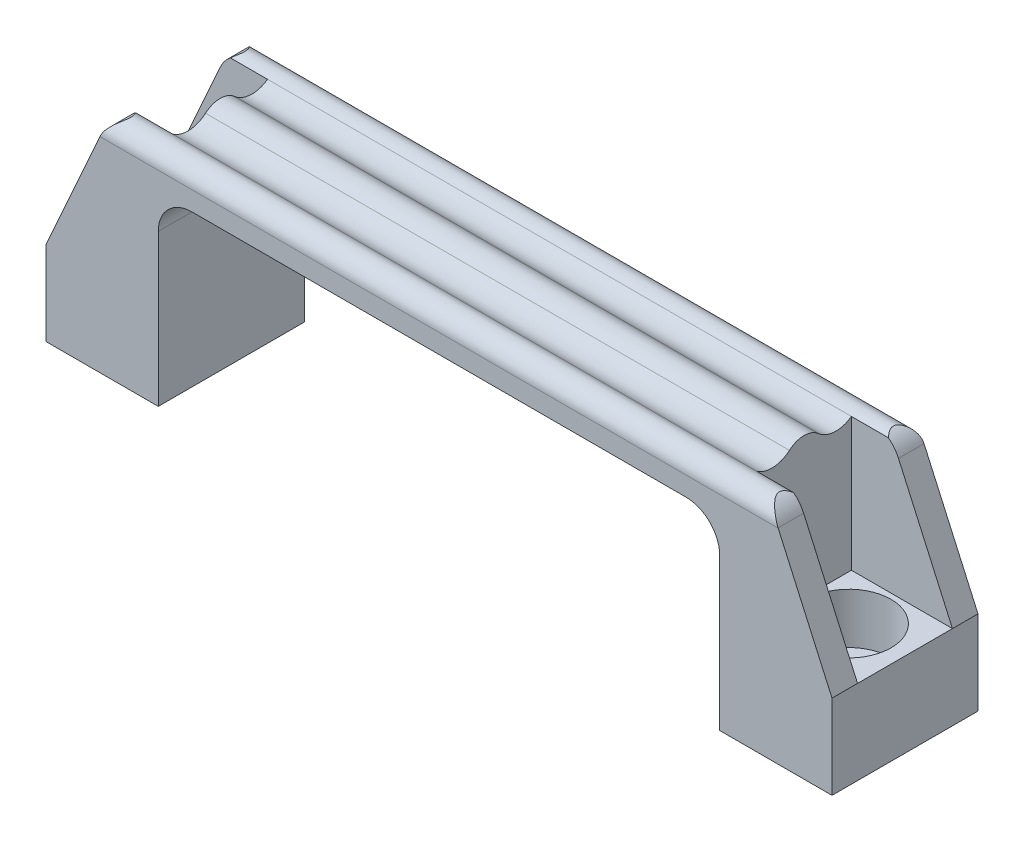
from build123d import *

# Parameters (mm, degrees)
EXTRUDE_START            = 13
EXTRUDE_1_DEPTH          = 26
CUT_EXTRUDE_1_DEPTH      = 70
CUT_EXTRUDE_1_DEPTH_BACK = 70
CUT_EXTRUDE_START        = 15
SKETCH_5_W               = 18
SKETCH_5_H               = 16.9
CUT_EXTRUDE_2_DEPTH      = 25
CUT_EXTRUDE_START_2      = 52.5
SKETCH_7_W               = 1.68
SKETCH_7_H               = 11.25
CUT_EXTRUDE_3_DEPTH      = 15
CUT_EXTRUDE_START_3      = -67.5
SKETCH_7_2_W             = 1.68
SKETCH_7_2_H             = 11.25
CUT_EXTRUDE_4_DEPTH      = 15


with BuildPart() as part:
    # 草图3 → 凸台-拉伸1 (new body)
    with BuildSketch(Plane.XY.offset(EXTRUDE_START)):
        with BuildLine():
            Line((-70, 15), (-60.389021238, 36.453077594))
            ThreePointArc((-60.389021238, 36.453077594), (-58.175420496, 39.035795149), (-54.913401609, 40))
            Line((-54.913401609, 40), (54.913401609, 40))
            ThreePointArc((54.913401609, 40), (58.175420496, 39.035795149), (60.389021238, 36.453077594))
            Line((60.389021238, 36.453077594), (70, 15))
            Line((70, 15), (70, 0))
            Line((70, 0), (50, 0))
            Line((50, 0), (50, 27))
            ThreePointArc((50, 27), (48.242640687, 31.242640687), (44, 33))
            Line((44, 33), (-44, 33))
            ThreePointArc((-44, 33), (-48.242640687, 31.242640687), (-50, 27))
            Line((-50, 27), (-50, 0))
            Line((-50, 0), (-70, 0))
            Line((-70, 0), (-70, 15))
        make_face()
    extrude(amount=-EXTRUDE_1_DEPTH)

    # 草图4 → 切除-拉伸1 (cut, two sides: drawn at the far end of the back side and taken through both)
    with BuildSketch(Plane(origin=(0, 0, 0), x_dir=(0, 0, -1), z_dir=(1, 0, 0)).offset(-CUT_EXTRUDE_1_DEPTH_BACK)):
        with BuildLine():
            Line((13, 36.42), (13, 33))
            Line((13, 33), (14, 33))
            Line((14, 33), (14, 41))
            Line((14, 41), (0, 41))
            Line((0, 41), (0, 40))
            ThreePointArc((0, 40), (1.385720645, 39.745514819), (2.590597511, 39.01527092))
            ThreePointArc((2.590597511, 39.01527092), (5.473035012, 37.839069568), (8.455602061, 38.731364009))
            ThreePointArc((8.455602061, 38.731364009), (11.436576626, 38.969213419), (13, 36.42))
        make_face()
        with BuildLine():
            Line((-14, 33), (-13, 33))
            Line((-13, 33), (-13, 36.42))
            ThreePointArc((-13, 36.42), (-11.436576626, 38.969213419), (-8.455602061, 38.731364009))
            ThreePointArc((-8.455602061, 38.731364009), (-5.473035012, 37.839069568), (-2.590597511, 39.01527092))
            ThreePointArc((-2.590597511, 39.01527092), (-1.385720645, 39.745514819), (0, 40))
            Line((0, 40), (0, 41))
            Line((0, 41), (-14, 41))
            Line((-14, 41), (-14, 33))
        make_face()
    extrude(amount=CUT_EXTRUDE_1_DEPTH + CUT_EXTRUDE_1_DEPTH_BACK, mode=Mode.SUBTRACT)

    # 草图5 → 切除-拉伸2 (cut)
    with BuildSketch(Plane(origin=(0, 0, 0), x_dir=(1, 0, 0), z_dir=(0, 1, 0)).offset(CUT_EXTRUDE_START)):
        with Locations((-61, 0)):
            Rectangle(SKETCH_5_W, SKETCH_5_H)
        with Locations((61, 0)):
            Rectangle(SKETCH_5_W, SKETCH_5_H)
    extrude(amount=CUT_EXTRUDE_2_DEPTH, mode=Mode.SUBTRACT)

    # 草图6 → 切除-旋转1 (revolve, cut)
    with BuildSketch(Plane.XY, mode=Mode.PRIVATE) as cut_revolve_1_sk:
        Polygon((-64.25, 0), (-64.25, 6), (-67.5, 6), (-67.5, 15), (-60, 15), (-60, 0), align=None)
    cut_revolve_1 = revolve(cut_revolve_1_sk.sketch.rotate(Axis((-60, 0, 0), (0, 1, 0)), 270), axis=Axis((-60, 0, 0), (0, 1, 0)), mode=Mode.SUBTRACT)

    # 镜向1: 切除-旋转1 across plane
    add(cut_revolve_1.mirror(Plane(origin=(0, 0, 0), x_dir=(0, 0, 1), z_dir=(1, 0, 0))), mode=Mode.SUBTRACT)

    # 草图7 → 切除-拉伸3 (cut)
    with BuildSketch(Plane(origin=(0, 0, 0), x_dir=(0, 0, -1), z_dir=(1, 0, 0)).offset(CUT_EXTRUDE_START_2)):
        with Locations((8.45, 5.625)):
            Rectangle(SKETCH_7_W, SKETCH_7_H)
        with Locations((-8.45, 5.625)):
            Rectangle(SKETCH_7_W, SKETCH_7_H)
    extrude(amount=CUT_EXTRUDE_3_DEPTH, mode=Mode.SUBTRACT)

    # 草图7<2> → 切除-拉伸4 (cut)
    with BuildSketch(Plane(origin=(0, 0, 0), x_dir=(0, 0, -1), z_dir=(1, 0, 0)).offset(CUT_EXTRUDE_START_3)):
        with Locations((8.45, 5.625)):
            Rectangle(SKETCH_7_2_W, SKETCH_7_2_H)
        with Locations((-8.45, 5.625)):
            Rectangle(SKETCH_7_2_W, SKETCH_7_2_H)
    extrude(amount=CUT_EXTRUDE_4_DEPTH, mode=Mode.SUBTRACT)


solid = part.part
